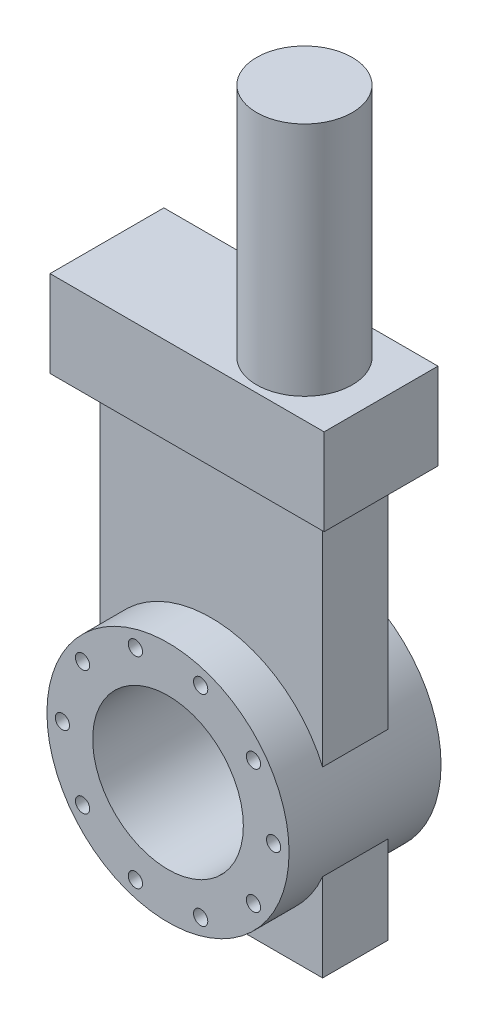
from build123d import *

# Parameters (mm, degrees)
SKETCH1_W                = 107.95
SKETCH1_H                = 220.345
EXTRUDE1_DEPTH           = 31.75
EXTRUDE2_DEPTH           = 20.955
EXTRUDE2_DEPTH_BACK      = 52.705
SKETCH2_R                = 58.674
SKETCH3_R                = 36.5125
EXTRUDE3_DEPTH           = 223.438643032
F_5_16_24_TAPPED_HOLE1_D = 6.9088
CIRPATTERN1_COUNT        = 10
EXTRUDE4_DEPTH           = 20.955
EXTRUDE4_DEPTH_BACK      = 20.955
SKETCH7_W                = 132.842
SKETCH7_H                = 55.172869126
SKETCH8_R                = 23.174591889
EXTRUDE5_DEPTH           = 114.3


with BuildPart() as part:
    # Sketch1 → Extrude1 (new body)
    with BuildSketch(Plane.XY):
        with Locations((24.778661236, -82.412046749)):
            Rectangle(SKETCH1_W, SKETCH1_H)
    extrude(amount=EXTRUDE1_DEPTH)

    # Sketch2 → Extrude2 (add, two sides: drawn at the far end of the back side and taken through both)
    with BuildSketch(Plane.XY.offset(31.75).offset(-EXTRUDE2_DEPTH_BACK)):
        with Locations((24.778661236, -127.052546749)):
            Circle(SKETCH2_R)
    extrude(amount=EXTRUDE2_DEPTH + EXTRUDE2_DEPTH_BACK)

    # Sketch3 → Extrude3 (cut, through all)
    with BuildSketch(Plane.XY.offset(52.705)):
        with Locations((24.778661236, -127.052546749)):
            Circle(SKETCH3_R)
    extrude(amount=-EXTRUDE3_DEPTH, mode=Mode.SUBTRACT)

    # 5/16-24 Tapped Hole1 (through all)
    with Locations(Plane.XY.offset(52.705)):
        with Locations((8.962862447, -78.376523189)):
            f_5_16_24_tapped_hole1 = Hole(F_5_16_24_TAPPED_HOLE1_D / 2)

    # CirPattern1: 5/16-24 Tapped Hole1 ×10 about axis
    cirpattern1_axis = Axis((24.778661236, -127.052546749, 0), (0, 0, 1))
    for i in range(1, CIRPATTERN1_COUNT):
        add(f_5_16_24_tapped_hole1.rotate(cirpattern1_axis, i * 360 / CIRPATTERN1_COUNT), mode=Mode.SUBTRACT)

    # Sketch7 → Extrude4 (add, two sides: drawn at the far end of the back side and taken through both)
    with BuildSketch(Plane(origin=(0, 27.760453251, 0), x_dir=(1, 0, 0), z_dir=(0, 1, 0)).offset(-EXTRUDE4_DEPTH_BACK)):
        with Locations((24.778661236, -15.875)):
            Rectangle(SKETCH7_W, SKETCH7_H)
    extrude(amount=EXTRUDE4_DEPTH + EXTRUDE4_DEPTH_BACK)

    # Sketch8 → Extrude5 (add)
    with BuildSketch(Plane(origin=(0, 48.715453251, 0), x_dir=(1, 0, 0), z_dir=(0, 1, 0))):
        with Locations(Location((55.144248721, -16.946726617, 0), (0, 0, 90))):
            Circle(SKETCH8_R)
    extrude(amount=EXTRUDE5_DEPTH)


solid = part.part
